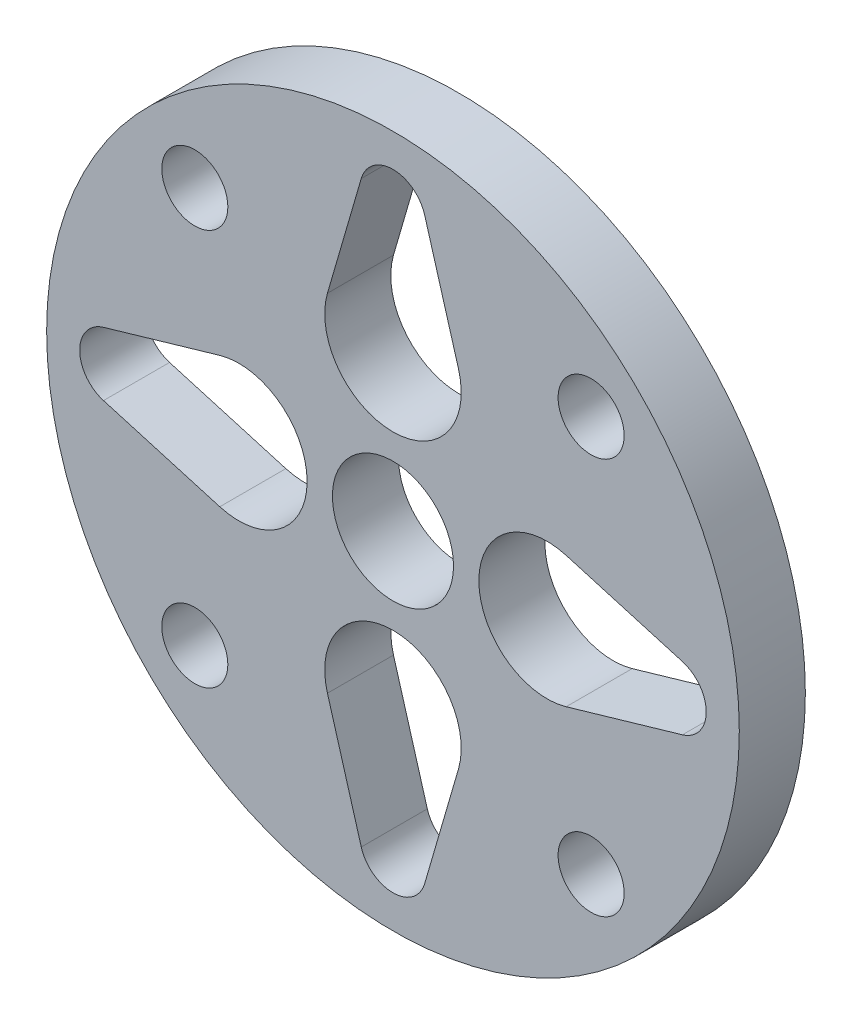
from build123d import *

# Parameters (mm, degrees)
MODEL_R                 = 15.73
MODEL_R_2               = 1.5
MODEL_R_3               = 2.75
SALIENTE_EXTRUIR1_DEPTH = 3


with BuildPart() as part:
    # Model → Saliente-Extruir1 (new body)
    with BuildSketch(Plane.XY):
        with Locations((22.468172618, 284.73044756)):
            Circle(MODEL_R)
        with Locations((13.468172618, 275.73044756)):
            Circle(MODEL_R_2, mode=Mode.SUBTRACT)
        with Locations((31.468172618, 275.73044756)):
            Circle(MODEL_R_2, mode=Mode.SUBTRACT)
        with Locations((31.468172618, 293.73044756)):
            Circle(MODEL_R_2, mode=Mode.SUBTRACT)
        with Locations((13.468172618, 293.73044756)):
            Circle(MODEL_R_2, mode=Mode.SUBTRACT)
        with Locations((22.468172618, 284.73044756)):
            Circle(MODEL_R_3, mode=Mode.SUBTRACT)
        with BuildLine():
            Line((23.908463874, 297.877369736), (25.444774548, 292.59638113))
            ThreePointArc((25.444774548, 292.59638113), (22.468172618, 288.63044756), (19.491570687, 292.59638113))
            Line((19.491570687, 292.59638113), (21.027881361, 297.877369736))
            ThreePointArc((21.027881361, 297.877369736), (22.468172618, 298.958369621), (23.908463874, 297.877369736))
        make_face(mode=Mode.SUBTRACT)
        with BuildLine():
            Line((9.321250442, 286.170738816), (14.602239048, 287.70704949))
            ThreePointArc((14.602239048, 287.70704949), (18.568172618, 284.73044756), (14.602239048, 281.753845629))
            Line((14.602239048, 281.753845629), (9.321250442, 283.290156303))
            ThreePointArc((9.321250442, 283.290156303), (8.240250556, 284.73044756), (9.321250442, 286.170738816))
        make_face(mode=Mode.SUBTRACT)
        with BuildLine():
            Line((21.027881361, 271.583525384), (19.491570687, 276.86451399))
            ThreePointArc((19.491570687, 276.86451399), (22.468172618, 280.83044756), (25.444774548, 276.86451399))
            Line((25.444774548, 276.86451399), (23.908463874, 271.583525384))
            ThreePointArc((23.908463874, 271.583525384), (22.468172618, 270.502525498), (21.027881361, 271.583525384))
        make_face(mode=Mode.SUBTRACT)
        with BuildLine():
            Line((35.615094794, 283.290156303), (30.334106188, 281.753845629))
            ThreePointArc((30.334106188, 281.753845629), (26.368172618, 284.73044756), (30.334106188, 287.70704949))
            Line((30.334106188, 287.70704949), (35.615094794, 286.170738816))
            ThreePointArc((35.615094794, 286.170738816), (36.696094679, 284.73044756), (35.615094794, 283.290156303))
        make_face(mode=Mode.SUBTRACT)
    extrude(amount=SALIENTE_EXTRUIR1_DEPTH)


solid = part.part
